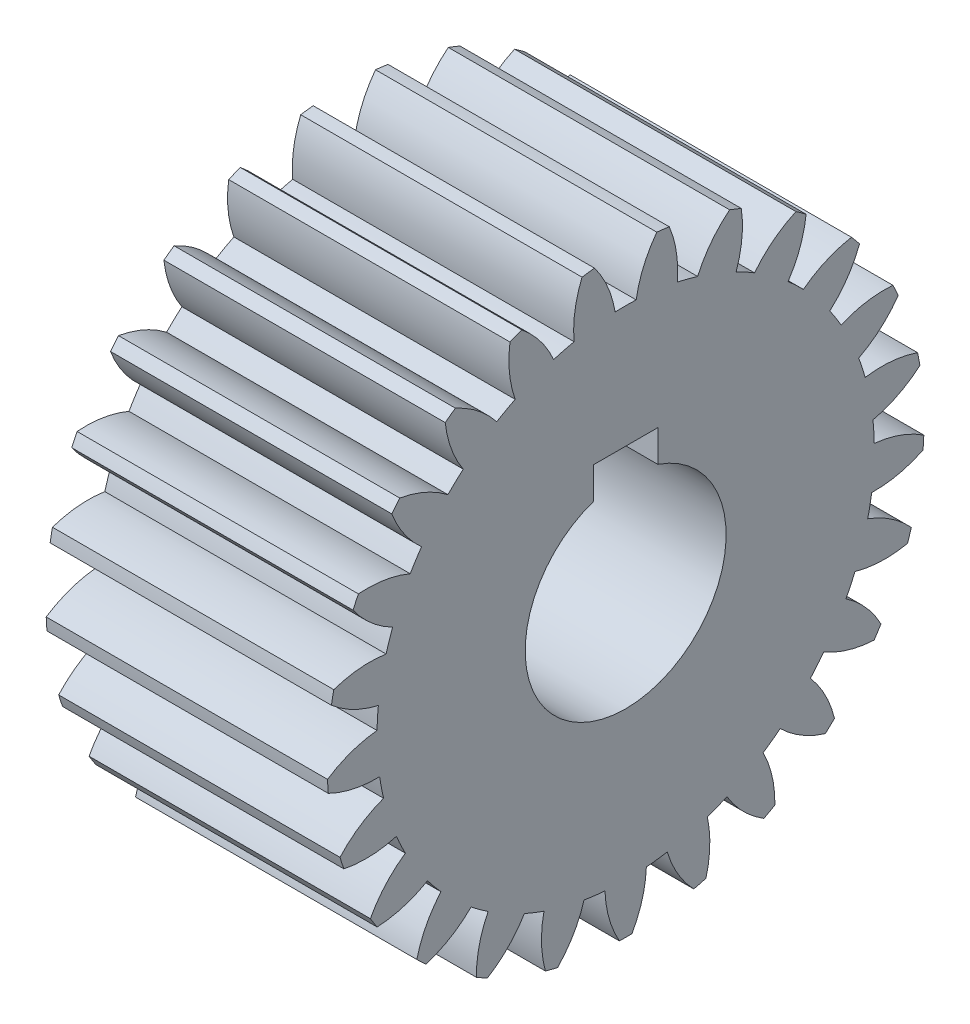
from build123d import *

# Parameters (mm, degrees)
BASPROSKE_W     = 35
BASPROSKE_H     = 37.125
TOOTHCUT_DEPTH  = 64.099375987
TEETHCUTS_COUNT = 25
TEETHCUTS_ANGLE = 345.6
BORSKE_R        = 12.5
BORE_DEPTH      = 50.0000508
KEYSKE_W        = 8
KEYSKE_H        = 15.8
KEYWAY_DEPTH    = 50.0000508


with BuildPart() as part:
    # BasProSke → Base-Revolve (revolve)
    with BuildSketch(Plane(origin=(0, 0, 0), x_dir=(1, 0, 0), z_dir=(0, 1, 0)), mode=Mode.PRIVATE) as base_revolve_sk:
        with Locations((17.5, 18.5625)):
            Rectangle(BASPROSKE_W, BASPROSKE_H)
    revolve(base_revolve_sk.sketch.rotate(Axis((-10, 0, 0), (1, 0, 0)), 180), axis=Axis((-10, 0, 0), (1, 0, 0)))

    # TooCutSke → ToothCut (cut, through all)
    with BuildSketch(Plane(origin=(0, 0, 0), x_dir=(0, 0, -1), z_dir=(1, 0, 0))):
        with BuildLine():
            ThreePointArc((1.308708101, 30.908806437), (0, 30.9365), (-1.308708101, 30.908806437))
            ThreePointArc((-1.308708101, 30.908806437), (-2.23516494, 34.083879999), (-3.893019277, 36.945860676))
            ThreePointArc((-3.893019277, 36.945860676), (0, 37.1504), (3.893019277, 36.945860676))
            ThreePointArc((3.893019277, 36.945860676), (2.23516494, 34.083879999), (1.308708101, 30.908806437))
        make_face()
    toothcut = extrude(amount=TOOTHCUT_DEPTH, mode=Mode.SUBTRACT)

    # TeethCuts: ToothCut ×25 about axis
    teethcuts_axis = Axis((-10, 0, 0), (1, 0, 0))
    for i in range(1, TEETHCUTS_COUNT):
        add(toothcut.rotate(teethcuts_axis, i * TEETHCUTS_ANGLE / (TEETHCUTS_COUNT - 1)), mode=Mode.SUBTRACT)

    # BorSke → Bore (cut, symmetric)
    with BuildSketch(Plane(origin=(0, 0, 0), x_dir=(0, 0, -1), z_dir=(1, 0, 0))):
        with Locations(Location((0, 0, 0), (0, 0, 180))):
            Circle(BORSKE_R)
    extrude(amount=BORE_DEPTH, both=True, mode=Mode.SUBTRACT)

    # KeySke → Keyway (cut, symmetric)
    with BuildSketch(Plane(origin=(0, 0, 0), x_dir=(0, 0, -1), z_dir=(1, 0, 0))):
        with Locations((0, 7.9)):
            Rectangle(KEYSKE_W, KEYSKE_H)
    extrude(amount=KEYWAY_DEPTH, both=True, mode=Mode.SUBTRACT)


solid = part.part
